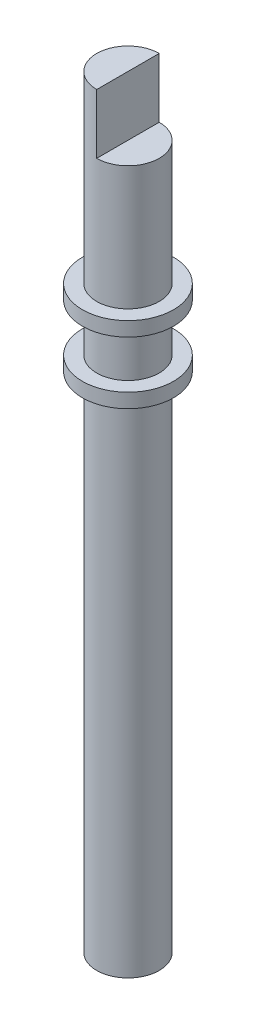
from build123d import *

# Parameters (mm, degrees)
SKETCH1_R           = 0.655
BOSS_EXTRUDE1_DEPTH = 16
CUT_EXTRUDE1_START  = -1.25
CUT_EXTRUDE1_DEPTH  = 1.25
SKETCH3_W           = 0.6
SKETCH3_H           = 0.3


with BuildPart() as part:
    # Sketch1 → Boss-Extrude1 (new body)
    with BuildSketch(Plane(origin=(0, 0, 0), x_dir=(1, 0, 0), z_dir=(0, 1, 0))):
        Circle(SKETCH1_R)
    extrude(amount=BOSS_EXTRUDE1_DEPTH)

    # Sketch2 → Cut-Extrude1 (cut)
    with BuildSketch(Plane(origin=(0, 16, 0), x_dir=(1, 0, 0), z_dir=(0, 1, 0)).offset(CUT_EXTRUDE1_START)):
        with BuildLine():
            Line((0, -0.655), (0, 0.655))
            ThreePointArc((0, 0.655), (0.655, 0), (0, -0.655))
        make_face()
    extrude(amount=CUT_EXTRUDE1_DEPTH, mode=Mode.SUBTRACT)

    # Sketch3 → Revolve1 (revolve)
    with BuildSketch(Plane.XY):
        with Locations((0.655, 12)):
            Rectangle(SKETCH3_W, SKETCH3_H)
        with Locations((0.655, 10.7)):
            Rectangle(SKETCH3_W, SKETCH3_H)
    revolve(axis=Axis((0, 16, 0), (0, -1, 0)))


solid = part.part
